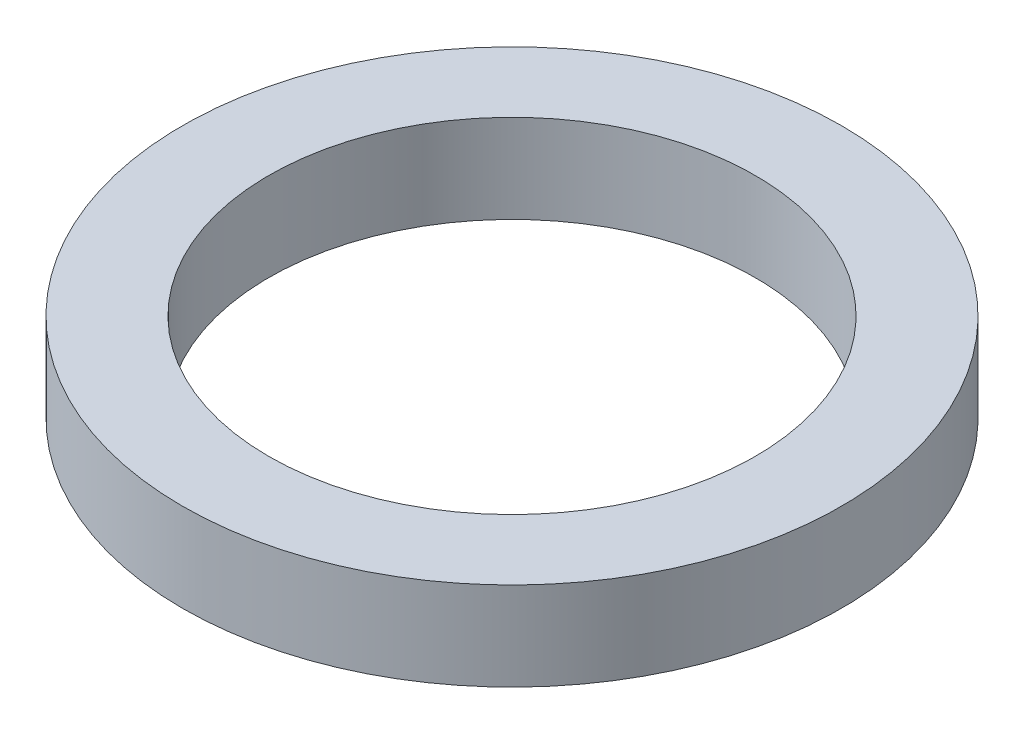
from build123d import *

# Parameters (mm, degrees)
SKETCH1_R           = 7.45
SKETCH1_R_2         = 5.5
BOSS_EXTRUDE1_DEPTH = 2


with BuildPart() as part:
    # Sketch1 → Boss-Extrude1 (new body)
    with BuildSketch(Plane(origin=(0, 0, 0), x_dir=(1, 0, 0), z_dir=(0, 1, 0))):
        with Locations(Location((0, 0, 0), (0, 0, 270))):
            Circle(SKETCH1_R)
        with Locations(Location((0, 0, 0), (0, 0, 270))):
            Circle(SKETCH1_R_2, mode=Mode.SUBTRACT)
    extrude(amount=BOSS_EXTRUDE1_DEPTH)


solid = part.part
